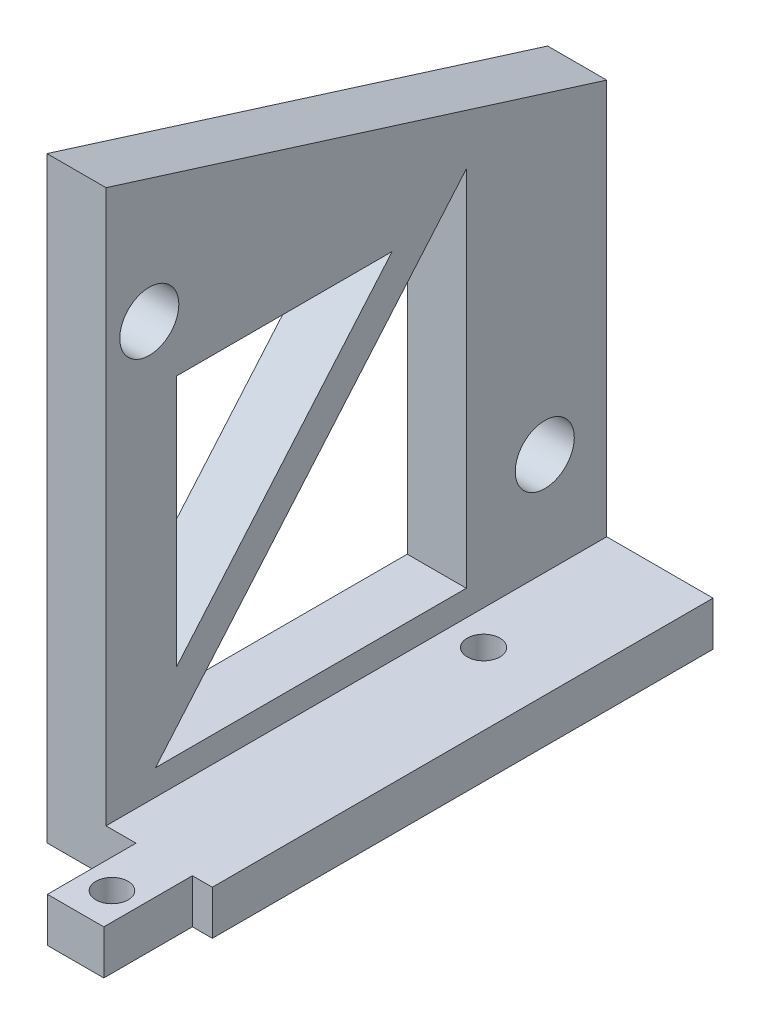
from build123d import *

# Parameters (mm, degrees)
SKETCH2_R           = 2.54
BOSS_EXTRUDE1_DEPTH = 5.08
SKETCH2_3_W         = 43.072058764
SKETCH2_3_H         = 3.81
BOSS_EXTRUDE2_DEPTH = 14.224
SKETCH3_R           = 1.40634392
CUT_EXTRUDE1_DEPTH  = 60.360259481
SKETCH4_W           = 4.849530786
SKETCH4_H           = 3.81
BOSS_EXTRUDE3_DEPTH = 7.62
SKETCH5_R           = 1.38768984
CUT_EXTRUDE2_DEPTH  = 64.860340465


with BuildPart() as part:
    # Sketch2 → Boss-Extrude1 (new body)
    with BuildSketch(Plane(origin=(0, 0, 0), x_dir=(0, 0, -1), z_dir=(1, 0, 0))):
        Polygon((-32.574690201, 49.446642672), (-32.574690201, 1.905), (10.497368563, 1.905), (10.497368563, 35.924444265), align=None)
        Polygon((-26.524187902, 10.6934), (-26.524187902, 32.381969715), (-7.962941991, 32.381969715), align=None, mode=Mode.SUBTRACT)
        Polygon((-28.317741421, 4.108230491), (-1.581280818, 35.349430166), (-1.581280818, 4.108230491), align=None, mode=Mode.SUBTRACT)
        with Locations((5.166357723, 10.6934)):
            Circle(SKETCH2_R, mode=Mode.SUBTRACT)
        with Locations((-28.852153042, 37.629948803)):
            Circle(SKETCH2_R, mode=Mode.SUBTRACT)
    extrude(amount=BOSS_EXTRUDE1_DEPTH)

    # Sketch2<3> → Boss-Extrude2 (add)
    with BuildSketch(Plane(origin=(0, 0, 0), x_dir=(0, 0, -1), z_dir=(1, 0, 0))):
        with Locations((-11.038660819, 0)):
            Rectangle(SKETCH2_3_W, SKETCH2_3_H)
    extrude(amount=BOSS_EXTRUDE2_DEPTH)

    # Sketch3 → Cut-Extrude1 (cut, through all)
    with BuildSketch(Plane(origin=(0, 1.905, 0), x_dir=(1, 0, 0), z_dir=(0, 1, 0))):
        with Locations((8.034839411, -3.04906194)):
            Circle(SKETCH3_R)
    extrude(amount=-CUT_EXTRUDE1_DEPTH, mode=Mode.SUBTRACT)

    # Sketch4 → Boss-Extrude3 (add)
    with BuildSketch(Plane.XY.offset(32.574690201)):
        with Locations((10.0846687, 0)):
            Rectangle(SKETCH4_W, SKETCH4_H)
    extrude(amount=BOSS_EXTRUDE3_DEPTH)

    # Sketch5 → Cut-Extrude2 (cut, through all)
    with BuildSketch(Plane(origin=(0, 1.905, 0), x_dir=(1, 0, 0), z_dir=(0, 1, 0))):
        with Locations((10.158864626, -37.143001749)):
            Circle(SKETCH5_R)
    extrude(amount=-CUT_EXTRUDE2_DEPTH, mode=Mode.SUBTRACT)


solid = part.part
